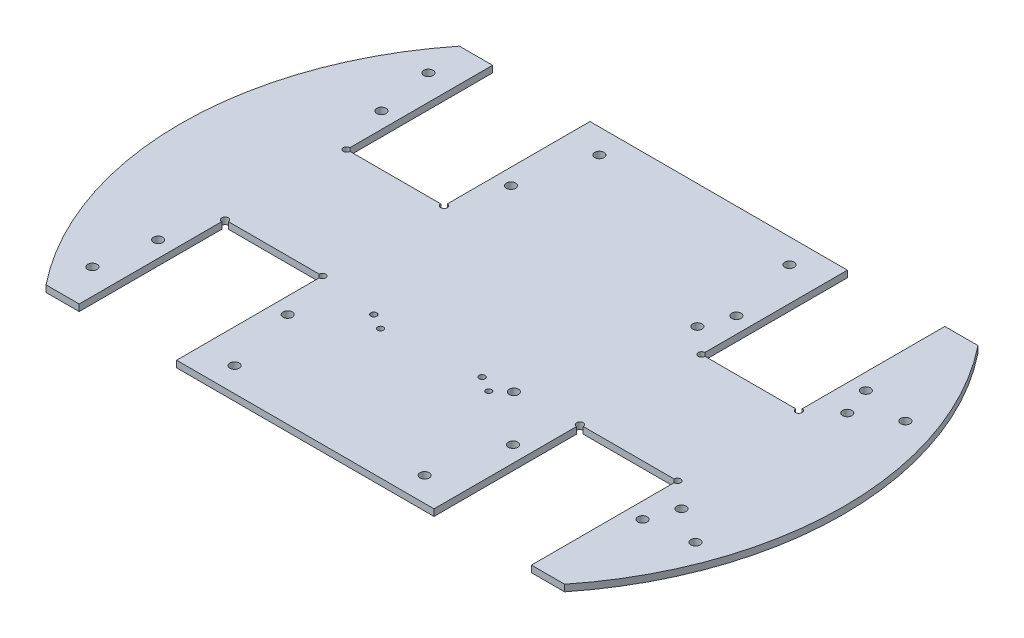
from build123d import *

# Parameters (mm, degrees)
BOSS_EXTRUDE1_DEPTH                        = 3
CUT_EXTRUDE1_REACH                         = 178.78
SKETCH2_R                                  = 2.1
SKETCH2_W                                  = 44.07
SKETCH2_H                                  = 66
MIRROR4_AT_THE_SECOND_PLANE_COPY_1_REACH   = 178.78
MIRROR4_AT_THE_SECOND_PLANE_COPY_1_SKETC_R = 2.1
MIRROR4_AT_THE_SECOND_PLANE_COPY_1_SKETC_W = 44.07
MIRROR4_AT_THE_SECOND_PLANE_COPY_1_SKETC_H = 66
SKETCH3_R                                  = 2.1
CUT_EXTRUDE2_DEPTH                         = 177.780230795
CUT_EXTRUDE5_REACH                         = 178.78
SKETCH6_R                                  = 1.35
SKETCH6_R_2                                = 2.1
SKETCH6_R_3                                = 1.3
CUT_EXTRUDE12_REACH                        = 178.78
SKETCH13_R                                 = 1.5
MIRROR6_AT_THE_SECOND_PLANE_COPY_1_REACH   = 178.78
MIRROR6_AT_THE_SECOND_PLANE_COPY_1_SKETC_R = 1.5


with BuildPart() as part:
    # Sketch1 → Boss-Extrude1 (new body)
    with BuildSketch(Plane(origin=(0, 0, 0), x_dir=(1, 0, 0), z_dir=(0, 1, 0))):
        with BuildLine():
            Line((-117.293435451, 93.5), (117.293435451, 93.5))
            ThreePointArc((117.293435451, 93.5), (150, 0), (117.293435451, -93.5))
            Line((117.293435451, -93.5), (-117.293435451, -93.5))
            ThreePointArc((-117.293435451, -93.5), (-150, 0), (-117.293435451, 93.5))
        make_face()
    extrude(amount=BOSS_EXTRUDE1_DEPTH)

    # Sketch2 → Cut-Extrude1 (cut, up to next)
    with BuildSketch(Plane(origin=(0, 3, 0), x_dir=(1, 0, 0), z_dir=(0, 1, 0)), mode=Mode.PRIVATE) as cut_extrude1_sk1:
        with Locations((-109.548435451, 50.5)):
            Circle(SKETCH2_R)
    cut_extrude1_tool1 = extrude(cut_extrude1_sk1.sketch, amount=-CUT_EXTRUDE1_REACH, mode=Mode.PRIVATE) & part.part
    # Sketch2 → Cut-Extrude1 (cut, up to next)
    with BuildSketch(Plane(origin=(0, 3, 0), x_dir=(1, 0, 0), z_dir=(0, 1, 0)), mode=Mode.PRIVATE) as cut_extrude1_sk2:
        with Locations((-50.968435451, 50.5)):
            Circle(SKETCH2_R)
    cut_extrude1_tool2 = extrude(cut_extrude1_sk2.sketch, amount=-CUT_EXTRUDE1_REACH, mode=Mode.PRIVATE) & part.part
    # Sketch2 → Cut-Extrude1 (cut, up to next)
    with BuildSketch(Plane(origin=(0, 3, 0), x_dir=(1, 0, 0), z_dir=(0, 1, 0)), mode=Mode.PRIVATE) as cut_extrude1_sk3:
        with Locations((-80.258435451, 60.5)):
            Rectangle(SKETCH2_W, SKETCH2_H)
    cut_extrude1_tool3 = extrude(cut_extrude1_sk3.sketch, amount=-CUT_EXTRUDE1_REACH, mode=Mode.PRIVATE) & part.part
    cut_extrude1_1 = cut_extrude1_tool1.solids().sort_by_distance((-109.548435, 3, -50.5))[0]
    add(cut_extrude1_1, mode=Mode.SUBTRACT)
    cut_extrude1_2 = cut_extrude1_tool2.solids().sort_by_distance((-50.968435, 3, -50.5))[0]
    add(cut_extrude1_2, mode=Mode.SUBTRACT)
    cut_extrude1_3 = cut_extrude1_tool3.solids().sort_by_distance((-80.258435, 3, -60.5))[0]
    add(cut_extrude1_3, mode=Mode.SUBTRACT)
    cut_extrude1 = cut_extrude1_1 + cut_extrude1_2 + cut_extrude1_3  # Cut-Extrude1 as one shape, for the pattern or mirror that repeats it

    # Mirror4: Cut-Extrude1 across plane
    add(cut_extrude1.mirror(Plane.XY), mode=Mode.SUBTRACT)

    # Mirror4 at the second plane: Cut-Extrude1 across plane
    add(cut_extrude1.mirror(Plane(origin=(0, 0, 0), x_dir=(0, 0, 1), z_dir=(1, 0, 0))), mode=Mode.SUBTRACT)

    # Mirror4 at the second plane copy 1 sketc → Mirror4 at the second plane copy 1 (cut, up to next)
    with BuildSketch(Plane(origin=(0, 3, 0), x_dir=(-1, 0, 0), z_dir=(0, 1, 0)), mode=Mode.PRIVATE) as mirror4_at_the_second_plane_copy_1_sk1:
        with Locations((-109.548435451, 50.5)):
            Circle(MIRROR4_AT_THE_SECOND_PLANE_COPY_1_SKETC_R)
    mirror4_at_the_second_plane_copy_1_tool1 = extrude(mirror4_at_the_second_plane_copy_1_sk1.sketch, amount=-MIRROR4_AT_THE_SECOND_PLANE_COPY_1_REACH, mode=Mode.PRIVATE) & part.part
    # Mirror4 at the second plane copy 1 sketc → Mirror4 at the second plane copy 1 (cut, up to next)
    with BuildSketch(Plane(origin=(0, 3, 0), x_dir=(-1, 0, 0), z_dir=(0, 1, 0)), mode=Mode.PRIVATE) as mirror4_at_the_second_plane_copy_1_sk2:
        with Locations((-50.968435451, 50.5)):
            Circle(MIRROR4_AT_THE_SECOND_PLANE_COPY_1_SKETC_R)
    mirror4_at_the_second_plane_copy_1_tool2 = extrude(mirror4_at_the_second_plane_copy_1_sk2.sketch, amount=-MIRROR4_AT_THE_SECOND_PLANE_COPY_1_REACH, mode=Mode.PRIVATE) & part.part
    # Mirror4 at the second plane copy 1 sketc → Mirror4 at the second plane copy 1 (cut, up to next)
    with BuildSketch(Plane(origin=(0, 3, 0), x_dir=(-1, 0, 0), z_dir=(0, 1, 0)), mode=Mode.PRIVATE) as mirror4_at_the_second_plane_copy_1_sk3:
        with Locations((-80.258435451, 60.5)):
            Rectangle(MIRROR4_AT_THE_SECOND_PLANE_COPY_1_SKETC_W, MIRROR4_AT_THE_SECOND_PLANE_COPY_1_SKETC_H)
    mirror4_at_the_second_plane_copy_1_tool3 = extrude(mirror4_at_the_second_plane_copy_1_sk3.sketch, amount=-MIRROR4_AT_THE_SECOND_PLANE_COPY_1_REACH, mode=Mode.PRIVATE) & part.part
    add(mirror4_at_the_second_plane_copy_1_tool1.solids().sort_by_distance((109.548435, 3, 50.5))[0], mode=Mode.SUBTRACT)
    add(mirror4_at_the_second_plane_copy_1_tool2.solids().sort_by_distance((50.968435, 3, 50.5))[0], mode=Mode.SUBTRACT)
    add(mirror4_at_the_second_plane_copy_1_tool3.solids().sort_by_distance((80.258435, 3, 60.5))[0], mode=Mode.SUBTRACT)

    # Sketch3 → Cut-Extrude2 (cut, through all)
    with BuildSketch(Plane(origin=(0, 3, 0), x_dir=(1, 0, 0), z_dir=(0, 1, 0))):
        with Locations((-42.993435451, 82.5)):
            Circle(SKETCH3_R)
        with Locations((42.993435451, 82.5)):
            Circle(SKETCH3_R)
        with Locations((-113.813435451, 76)):
            Circle(SKETCH3_R)
        with Locations((130.463435451, 47.48)):
            Circle(SKETCH3_R)
        with Locations((130.463435451, -47.48)):
            Circle(SKETCH3_R)
        with Locations((42.993435451, -82.5)):
            Circle(SKETCH3_R)
        with Locations((-42.993435451, -82.5)):
            Circle(SKETCH3_R)
        with Locations((-113.813435451, -76)):
            Circle(SKETCH3_R)
    extrude(amount=-CUT_EXTRUDE2_DEPTH, mode=Mode.SUBTRACT)

    # Sketch6 → Cut-Extrude5 (cut, up to next)
    with BuildSketch(Plane(origin=(0, 3, 0), x_dir=(1, 0, 0), z_dir=(0, 1, 0)), mode=Mode.PRIVATE) as cut_extrude5_sk1:
        with Locations((-31.526564549, -31)):
            Circle(SKETCH6_R)
    cut_extrude5_tool1 = extrude(cut_extrude5_sk1.sketch, amount=-CUT_EXTRUDE5_REACH, mode=Mode.PRIVATE) & part.part
    # Sketch6 → Cut-Extrude5 (cut, up to next)
    with BuildSketch(Plane(origin=(0, 3, 0), x_dir=(1, 0, 0), z_dir=(0, 1, 0)), mode=Mode.PRIVATE) as cut_extrude5_sk2:
        with Locations((17.473435451, -31)):
            Circle(SKETCH6_R)
    cut_extrude5_tool2 = extrude(cut_extrude5_sk2.sketch, amount=-CUT_EXTRUDE5_REACH, mode=Mode.PRIVATE) & part.part
    # Sketch6 → Cut-Extrude5 (cut, up to next)
    with BuildSketch(Plane(origin=(0, 3, 0), x_dir=(1, 0, 0), z_dir=(0, 1, 0)), mode=Mode.PRIVATE) as cut_extrude5_sk3:
        with Locations((114.153435451, 37.485)):
            Circle(SKETCH6_R_2)
    cut_extrude5_tool3 = extrude(cut_extrude5_sk3.sketch, amount=-CUT_EXTRUDE5_REACH, mode=Mode.PRIVATE) & part.part
    # Sketch6 → Cut-Extrude5 (cut, up to next)
    with BuildSketch(Plane(origin=(0, 3, 0), x_dir=(1, 0, 0), z_dir=(0, 1, 0)), mode=Mode.PRIVATE) as cut_extrude5_sk4:
        with Locations((114.153435451, -37.485)):
            Circle(SKETCH6_R_2)
    cut_extrude5_tool4 = extrude(cut_extrude5_sk4.sketch, amount=-CUT_EXTRUDE5_REACH, mode=Mode.PRIVATE) & part.part
    # Sketch6 → Cut-Extrude5 (cut, up to next)
    with BuildSketch(Plane(origin=(0, 3, 0), x_dir=(1, 0, 0), z_dir=(0, 1, 0)), mode=Mode.PRIVATE) as cut_extrude5_sk5:
        with Locations((46.363435451, 37.485)):
            Circle(SKETCH6_R_2)
    cut_extrude5_tool5 = extrude(cut_extrude5_sk5.sketch, amount=-CUT_EXTRUDE5_REACH, mode=Mode.PRIVATE) & part.part
    # Sketch6 → Cut-Extrude5 (cut, up to next)
    with BuildSketch(Plane(origin=(0, 3, 0), x_dir=(1, 0, 0), z_dir=(0, 1, 0)), mode=Mode.PRIVATE) as cut_extrude5_sk6:
        with Locations((-24.5, -35)):
            Circle(SKETCH6_R_3)
    cut_extrude5_tool6 = extrude(cut_extrude5_sk6.sketch, amount=-CUT_EXTRUDE5_REACH, mode=Mode.PRIVATE) & part.part
    # Sketch6 → Cut-Extrude5 (cut, up to next)
    with BuildSketch(Plane(origin=(0, 3, 0), x_dir=(1, 0, 0), z_dir=(0, 1, 0)), mode=Mode.PRIVATE) as cut_extrude5_sk7:
        with Locations((24.5, -35)):
            Circle(SKETCH6_R_3)
    cut_extrude5_tool7 = extrude(cut_extrude5_sk7.sketch, amount=-CUT_EXTRUDE5_REACH, mode=Mode.PRIVATE) & part.part
    # Sketch6 → Cut-Extrude5 (cut, up to next)
    with BuildSketch(Plane(origin=(0, 3, 0), x_dir=(1, 0, 0), z_dir=(0, 1, 0)), mode=Mode.PRIVATE) as cut_extrude5_sk8:
        with Locations((30.463435451, -29.615)):
            Circle(SKETCH6_R_2)
    cut_extrude5_tool8 = extrude(cut_extrude5_sk8.sketch, amount=-CUT_EXTRUDE5_REACH, mode=Mode.PRIVATE) & part.part
    add(cut_extrude5_tool1.solids().sort_by_distance((-31.526565, 3, 31))[0], mode=Mode.SUBTRACT)
    add(cut_extrude5_tool2.solids().sort_by_distance((17.473435, 3, 31))[0], mode=Mode.SUBTRACT)
    add(cut_extrude5_tool3.solids().sort_by_distance((114.153435, 3, -37.485))[0], mode=Mode.SUBTRACT)
    add(cut_extrude5_tool4.solids().sort_by_distance((114.153435, 3, 37.485))[0], mode=Mode.SUBTRACT)
    add(cut_extrude5_tool5.solids().sort_by_distance((46.363435, 3, -37.485))[0], mode=Mode.SUBTRACT)
    add(cut_extrude5_tool6.solids().sort_by_distance((-24.5, 3, 35))[0], mode=Mode.SUBTRACT)
    add(cut_extrude5_tool7.solids().sort_by_distance((24.5, 3, 35))[0], mode=Mode.SUBTRACT)
    add(cut_extrude5_tool8.solids().sort_by_distance((30.463435, 3, 29.615))[0], mode=Mode.SUBTRACT)

    # Sketch13 → Cut-Extrude12 (cut, up to next)
    with BuildSketch(Plane(origin=(0, 3, 0), x_dir=(1, 0, 0), z_dir=(0, 1, 0)), mode=Mode.PRIVATE) as cut_extrude12_sk1:
        with Locations((-102.293435451, 27.5)):
            Circle(SKETCH13_R)
    cut_extrude12_tool1 = extrude(cut_extrude12_sk1.sketch, amount=-CUT_EXTRUDE12_REACH, mode=Mode.PRIVATE) & part.part
    # Sketch13 → Cut-Extrude12 (cut, up to next)
    with BuildSketch(Plane(origin=(0, 3, 0), x_dir=(1, 0, 0), z_dir=(0, 1, 0)), mode=Mode.PRIVATE) as cut_extrude12_sk2:
        with Locations((-58.223435451, 27.5)):
            Circle(SKETCH13_R)
    cut_extrude12_tool2 = extrude(cut_extrude12_sk2.sketch, amount=-CUT_EXTRUDE12_REACH, mode=Mode.PRIVATE) & part.part
    cut_extrude12_1 = cut_extrude12_tool1.solids().sort_by_distance((-102.293435, 3, -27.5))[0]
    add(cut_extrude12_1, mode=Mode.SUBTRACT)
    cut_extrude12_2 = cut_extrude12_tool2.solids().sort_by_distance((-58.223435, 3, -27.5))[0]
    add(cut_extrude12_2, mode=Mode.SUBTRACT)
    cut_extrude12 = cut_extrude12_1 + cut_extrude12_2  # Cut-Extrude12 as one shape, for the pattern or mirror that repeats it

    # Mirror6: Cut-Extrude12 across plane
    add(cut_extrude12.mirror(Plane(origin=(0, 0, 0), x_dir=(0, 0, 1), z_dir=(1, 0, 0))), mode=Mode.SUBTRACT)

    # Mirror6 at the second plane: Cut-Extrude12 across plane
    add(cut_extrude12.mirror(Plane.XY), mode=Mode.SUBTRACT)

    # Mirror6 at the second plane copy 1 sketc → Mirror6 at the second plane copy 1 (cut, up to next)
    with BuildSketch(Plane(origin=(0, 3, 0), x_dir=(-1, 0, 0), z_dir=(0, 1, 0)), mode=Mode.PRIVATE) as mirror6_at_the_second_plane_copy_1_sk1:
        with Locations((-102.293435451, 27.5)):
            Circle(MIRROR6_AT_THE_SECOND_PLANE_COPY_1_SKETC_R)
    mirror6_at_the_second_plane_copy_1_tool1 = extrude(mirror6_at_the_second_plane_copy_1_sk1.sketch, amount=-MIRROR6_AT_THE_SECOND_PLANE_COPY_1_REACH, mode=Mode.PRIVATE) & part.part
    # Mirror6 at the second plane copy 1 sketc → Mirror6 at the second plane copy 1 (cut, up to next)
    with BuildSketch(Plane(origin=(0, 3, 0), x_dir=(-1, 0, 0), z_dir=(0, 1, 0)), mode=Mode.PRIVATE) as mirror6_at_the_second_plane_copy_1_sk2:
        with Locations((-58.223435451, 27.5)):
            Circle(MIRROR6_AT_THE_SECOND_PLANE_COPY_1_SKETC_R)
    mirror6_at_the_second_plane_copy_1_tool2 = extrude(mirror6_at_the_second_plane_copy_1_sk2.sketch, amount=-MIRROR6_AT_THE_SECOND_PLANE_COPY_1_REACH, mode=Mode.PRIVATE) & part.part
    add(mirror6_at_the_second_plane_copy_1_tool1.solids().sort_by_distance((102.293435, 3, 27.5))[0], mode=Mode.SUBTRACT)
    add(mirror6_at_the_second_plane_copy_1_tool2.solids().sort_by_distance((58.223435, 3, 27.5))[0], mode=Mode.SUBTRACT)


solid = part.part
